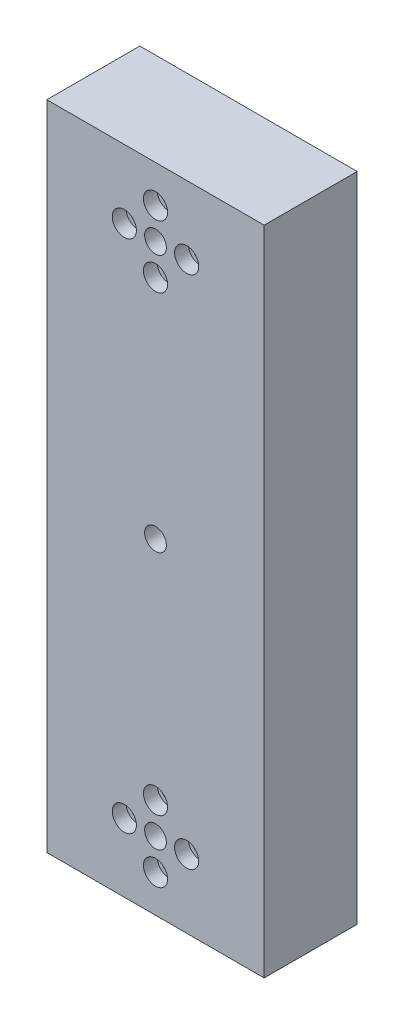
from build123d import *

# Parameters (mm, degrees)
SKETCH1_W                                        = 300
SKETCH1_H                                        = 100
SKETCH1_R                                        = 5
BOSS_EXTRUDE1_DEPTH                              = 42.8
CBORE_FOR_1_4_SOCKET_HEAD_CAP_SCREW1_D           = 7.1374
CBORE_FOR_1_4_SOCKET_HEAD_CAP_SCREW1_CBORE_D     = 11.1125
CBORE_FOR_1_4_SOCKET_HEAD_CAP_SCREW1_CBORE_DEPTH = 6.35


with BuildPart() as part:
    # Sketch1 → Boss-Extrude1 (new body)
    with BuildSketch(Plane(origin=(0, 0, 0), x_dir=(0, 1, 0), z_dir=(0, 0, 1))):
        Rectangle(SKETCH1_W, SKETCH1_H)
        with Locations(Location((0, 0, 0), (0, 0, 270))):
            Circle(SKETCH1_R, mode=Mode.SUBTRACT)
        with Locations(Location((-118.5, 0, 0), (0, 0, 270))):
            Circle(SKETCH1_R, mode=Mode.SUBTRACT)
        with Locations(Location((118.5, 0, 0), (0, 0, 90))):
            Circle(SKETCH1_R, mode=Mode.SUBTRACT)
    extrude(amount=-BOSS_EXTRUDE1_DEPTH)

    # CBORE for 1/4 Socket Head Cap Screw1 (through all)
    with Locations(Plane(origin=(0, 0, 0), x_dir=(0, -1, 0), z_dir=(0, 0, 1))):
        with Locations((118.5, 14.351), (132.851, 0), (118.5, -14.351), (104.149, 0), (-104.149, 0), (-118.5, 14.351), (-132.851, 0), (-118.5, -14.351)):
            CounterBoreHole(CBORE_FOR_1_4_SOCKET_HEAD_CAP_SCREW1_D / 2, CBORE_FOR_1_4_SOCKET_HEAD_CAP_SCREW1_CBORE_D / 2, CBORE_FOR_1_4_SOCKET_HEAD_CAP_SCREW1_CBORE_DEPTH)


solid = part.part
